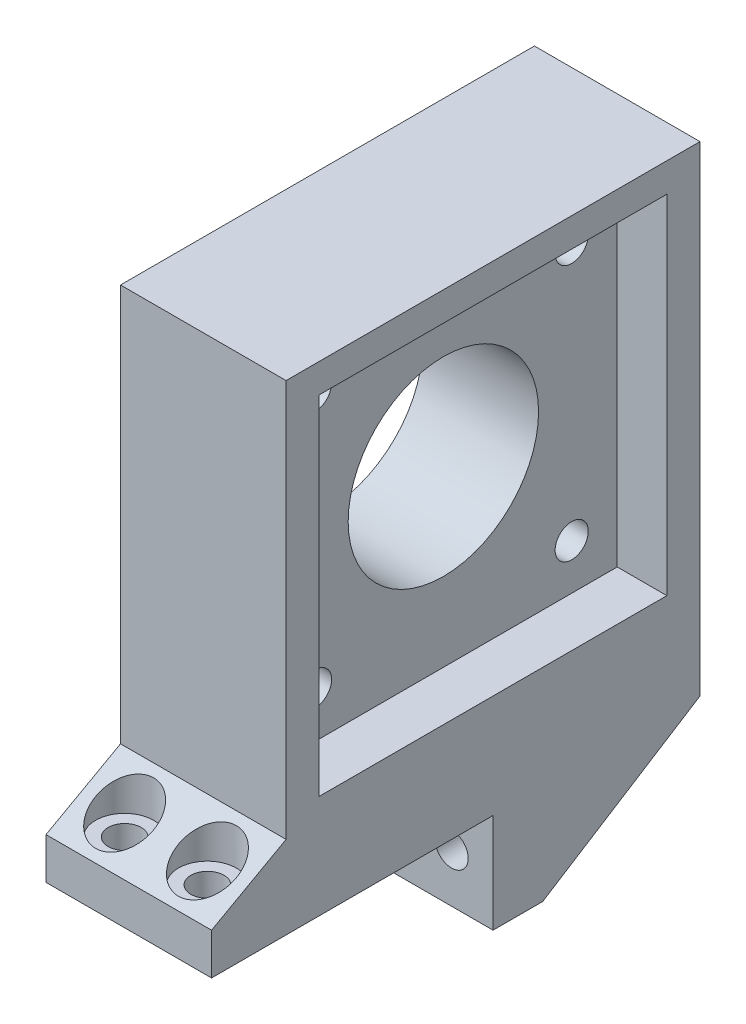
from build123d import *

# Parameters (mm, degrees)
SKETCH1_W           = 20
SKETCH1_H           = 50
BOSS_EXTRUDE1_DEPTH = 70
SKETCH2_R           = 2
SKETCH2_R_2         = 11.5
CUT_EXTRUDE2_DEPTH  = 60
SKETCH4_W           = 25
SKETCH4_H           = 12
CUT_EXTRUDE3_DEPTH  = 60
SKETCH8_R           = 2
CUT_EXTRUDE5_DEPTH  = 15
SKETCH9_W           = 42
SKETCH9_H           = 42
CUT_EXTRUDE6_DEPTH  = 6
CUT_EXTRUDE8_DEPTH  = 30
SKETCH12_W          = 20
SKETCH12_H          = 5
BOSS_EXTRUDE2_DEPTH = 9
BOSS_EXTRUDE3_DEPTH = 20
SKETCH15_R          = 2
CUT_EXTRUDE9_DEPTH  = 10
SKETCH18_R          = 3.5
CUT_EXTRUDE12_DEPTH = 53
SKETCH17_R          = 3.5
CUT_EXTRUDE13_DEPTH = 16
SKETCH19_R          = 2
CUT_EXTRUDE14_DEPTH = 25


with BuildPart() as part:
    # Sketch1 → Boss-Extrude1 (new body)
    with BuildSketch(Plane(origin=(0, 0, 0), x_dir=(1, 0, 0), z_dir=(0, 1, 0))):
        with Locations((-10, -25)):
            Rectangle(SKETCH1_W, SKETCH1_H)
    extrude(amount=BOSS_EXTRUDE1_DEPTH)

    # Sketch2 → Cut-Extrude2 (cut)
    with BuildSketch(Plane(origin=(0, 0, 0), x_dir=(0, 0, -1), z_dir=(1, 0, 0))):
        with Locations((-9.5, 61)):
            Circle(SKETCH2_R)
        with Locations((-25, 45.5)):
            Circle(SKETCH2_R_2)
        with Locations((-9.5, 30)):
            Circle(SKETCH2_R)
        with Locations((-40.5, 30)):
            Circle(SKETCH2_R)
        with Locations((-40.5, 61)):
            Circle(SKETCH2_R)
    extrude(amount=-CUT_EXTRUDE2_DEPTH, mode=Mode.SUBTRACT)

    # Sketch4 → Cut-Extrude3 (cut)
    with BuildSketch(Plane(origin=(0, 0, 0), x_dir=(0, 0, -1), z_dir=(1, 0, 0))):
        with Locations((-37.5, 6)):
            Rectangle(SKETCH4_W, SKETCH4_H)
    extrude(amount=-CUT_EXTRUDE3_DEPTH, mode=Mode.SUBTRACT)

    # Sketch8 → Cut-Extrude5 (cut)
    with BuildSketch(Plane(origin=(0, 0, 0), x_dir=(-1, 0, 0), z_dir=(0, 0, -1))):
        with Locations((15, 6)):
            Circle(SKETCH8_R)
        with Locations((5, 6)):
            Circle(SKETCH8_R)
    extrude(amount=-CUT_EXTRUDE5_DEPTH, mode=Mode.SUBTRACT)

    # Sketch9 → Cut-Extrude6 (cut)
    with BuildSketch(Plane(origin=(0, 0, 0), x_dir=(0, 0, -1), z_dir=(1, 0, 0))):
        with Locations((-25, 45.5)):
            Rectangle(SKETCH9_W, SKETCH9_H)
    extrude(amount=-CUT_EXTRUDE6_DEPTH, mode=Mode.SUBTRACT)

    # Sketch11 → Cut-Extrude8 (cut)
    with BuildSketch(Plane(origin=(0, 0, 0), x_dir=(0, 0, -1), z_dir=(1, 0, 0))):
        Polygon((-19, 0), (0, 0), (0, 12), align=None)
    extrude(amount=-CUT_EXTRUDE8_DEPTH, mode=Mode.SUBTRACT)

    # Sketch12 → Boss-Extrude2 (add)
    with BuildSketch(Plane.XY.offset(50)):
        with Locations((-10, 14.5)):
            Rectangle(SKETCH12_W, SKETCH12_H)
    extrude(amount=BOSS_EXTRUDE2_DEPTH)

    # Sketch14 → Boss-Extrude3 (add)
    with BuildSketch(Plane(origin=(0, 0, 0), x_dir=(0, 0, -1), z_dir=(1, 0, 0))):
        Polygon((-50, 17), (-59, 17), (-50, 22), align=None)
    extrude(amount=-BOSS_EXTRUDE3_DEPTH)

    # Sketch15 → Cut-Extrude9 (cut)
    with BuildSketch(Plane(origin=(0, 12, 0), x_dir=(-1, 0, 0), z_dir=(0, -1, 0))):
        with Locations(Location((5, -54.5, 0), (0, 0, 90))):
            Circle(SKETCH15_R)
        with Locations(Location((15, -54.5, 0), (0, 0, 90))):
            Circle(SKETCH15_R)
    extrude(amount=-CUT_EXTRUDE9_DEPTH, mode=Mode.SUBTRACT)

    # Sketch18 → Cut-Extrude12 (cut)
    with BuildSketch(Plane(origin=(0, 70, 0), x_dir=(1, 0, 0), z_dir=(0, 1, 0))):
        with Locations(Location((-15, -54.5, 0), (0, 0, 270))):
            Circle(SKETCH18_R)
        with Locations(Location((-5, -54.5, 0), (0, 0, 270))):
            Circle(SKETCH18_R)
    extrude(amount=-CUT_EXTRUDE12_DEPTH, mode=Mode.SUBTRACT)

    # Sketch17 → Cut-Extrude13 (cut)
    with BuildSketch(Plane(origin=(0, 0, 0), x_dir=(-1, 0, 0), z_dir=(0, 0, -1))):
        with Locations((15, 6)):
            Circle(SKETCH17_R)
        with Locations((5, 6)):
            Circle(SKETCH17_R)
    extrude(amount=-CUT_EXTRUDE13_DEPTH, mode=Mode.SUBTRACT)

    # Sketch19 → Cut-Extrude14 (cut)
    with BuildSketch(Plane(origin=(0, 0, 16), x_dir=(-1, 0, 0), z_dir=(0, 0, -1))):
        with Locations((5, 6)):
            Circle(SKETCH19_R)
        with Locations((15, 6)):
            Circle(SKETCH19_R)
    extrude(amount=-CUT_EXTRUDE14_DEPTH, mode=Mode.SUBTRACT)


solid = part.part
